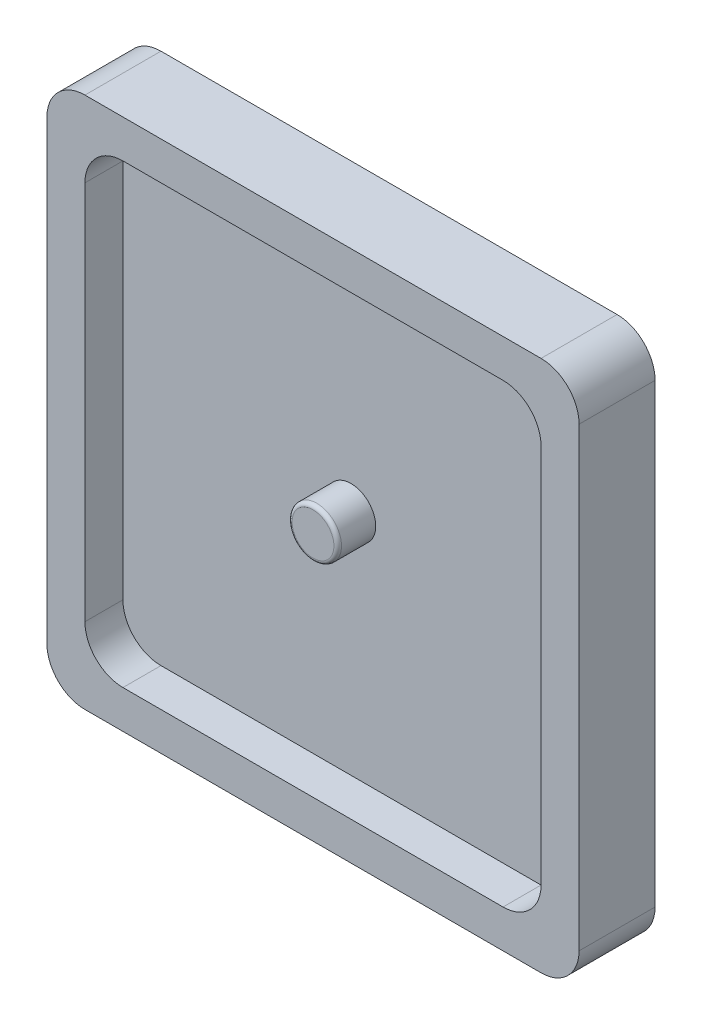
from build123d import *

# Parameters (mm, degrees)
ESQUISSE1_W             = 140
ESQUISSE1_H             = 140
BOSS_EXTRU_1_DEPTH      = 20
ESQUISSE2_W             = 120
ESQUISSE2_H             = 120
ENL_V_MAT_EXTRU_1_DEPTH = 10
CONG_1_R                = 10
CONG_2_R                = 10
ESQUISSE3_R             = 6.5
BOSS_EXTRU_2_DEPTH      = 10
CONG_3_R                = 1


with BuildPart() as part:
    # Esquisse1 → Boss.-Extru.1 (new body)
    with BuildSketch(Plane.XY):
        Rectangle(ESQUISSE1_W, ESQUISSE1_H)
    extrude(amount=BOSS_EXTRU_1_DEPTH)

    # Esquisse2 → Enlèv. mat.-Extru.1 (cut)
    with BuildSketch(Plane.XY.offset(20)):
        Rectangle(ESQUISSE2_W, ESQUISSE2_H)
    extrude(amount=-ENL_V_MAT_EXTRU_1_DEPTH, mode=Mode.SUBTRACT)

    # Congé1
    cong_1_edges = [part.edges().sort_by_distance(p)[0] for p in [
        (60, 60, 15),
        (60, -60, 15),
        (-60, -60, 15),
        (-60, 60, 15),
    ]]
    fillet(cong_1_edges, radius=CONG_1_R)

    # Congé2
    cong_2_edges = [part.edges().sort_by_distance(p)[0] for p in [
        (70, -70, 10),
        (-70, -70, 10),
        (-70, 70, 10),
        (70, 70, 10),
    ]]
    fillet(cong_2_edges, radius=CONG_2_R)

    # Esquisse3 → Boss.-Extru.2 (add)
    with BuildSketch(Plane.XY.offset(10)):
        with Locations(Location((0, 0, 0), (0, 0, 180))):
            Circle(ESQUISSE3_R)
    extrude(amount=BOSS_EXTRU_2_DEPTH)

    # Congé3
    cong_3_edges = [part.edges().sort_by_distance(p)[0] for p in [
        (6.5, 0, 20),
    ]]
    fillet(cong_3_edges, radius=CONG_3_R)


solid = part.part
